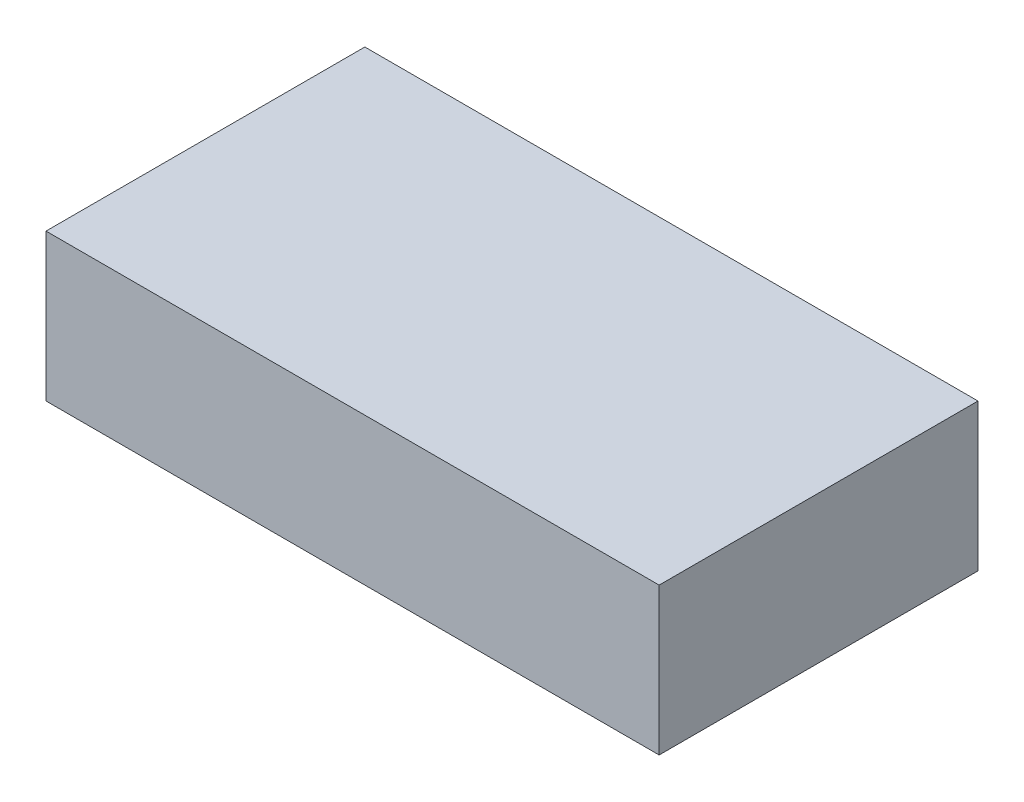
from build123d import *

# Parameters (mm, degrees)
SKETCH1_W           = 25
SKETCH1_H           = 13
BOSS_EXTRUDE1_DEPTH = 6


with BuildPart() as part:
    # Sketch1 → Boss-Extrude1 (new body)
    with BuildSketch(Plane(origin=(0, 0, 0), x_dir=(1, 0, 0), z_dir=(0, 1, 0))):
        with Locations((12.5, 6.5)):
            Rectangle(SKETCH1_W, SKETCH1_H)
    extrude(amount=BOSS_EXTRUDE1_DEPTH)


solid = part.part
